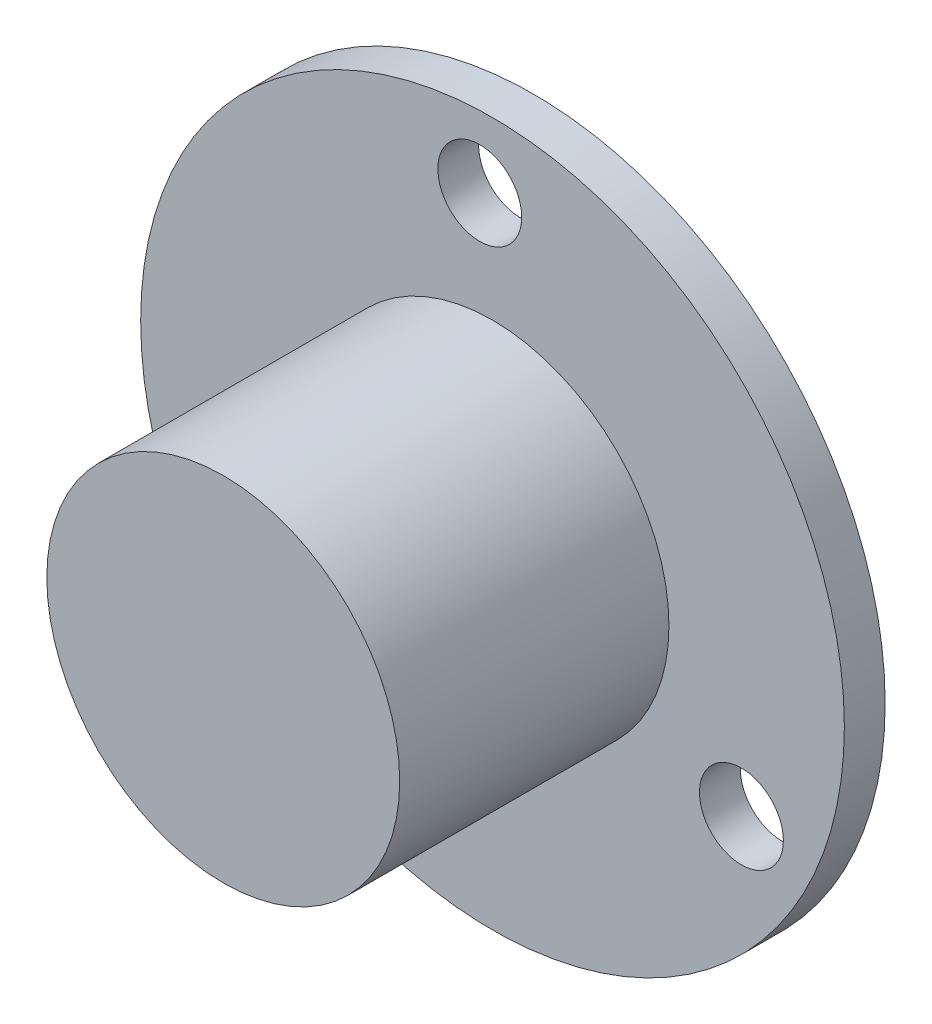
from build123d import *

# Parameters (mm, degrees)
SKETCH1_R           = 21.9075
SKETCH1_R_2         = 2.610660844
BOSS_EXTRUDE1_DEPTH = 2.54
SKETCH2_R           = 3.8735
BOSS_EXTRUDE2_DEPTH = 8.89
SKETCH3_R           = 10.9855
BOSS_EXTRUDE4_DEPTH = 16.764


with BuildPart() as part:
    # Sketch1 → Boss-Extrude1 (new body)
    with BuildSketch(Plane.XY):
        Circle(SKETCH1_R)
        with Locations((-0.793799024, 17.4371)):
            Circle(SKETCH1_R_2, mode=Mode.SUBTRACT)
        with Locations((15.49787108, -8.03109988)):
            Circle(SKETCH1_R_2, mode=Mode.SUBTRACT)
        with Locations((-14.704072056, -9.40600012)):
            Circle(SKETCH1_R_2, mode=Mode.SUBTRACT)
    extrude(amount=BOSS_EXTRUDE1_DEPTH)

    # Sketch2 → Boss-Extrude2 (add)
    with BuildSketch(Plane(origin=(0, 0, 0), x_dir=(-1, 0, 0), z_dir=(0, 0, -1))):
        with Locations(Location((0, 0, 0), (0, 0, 180))):
            Circle(SKETCH2_R)
    extrude(amount=BOSS_EXTRUDE2_DEPTH)

    # Sketch3 → Boss-Extrude4 (add)
    with BuildSketch(Plane.XY.offset(2.54)):
        Circle(SKETCH3_R)
    extrude(amount=BOSS_EXTRUDE4_DEPTH)


solid = part.part
